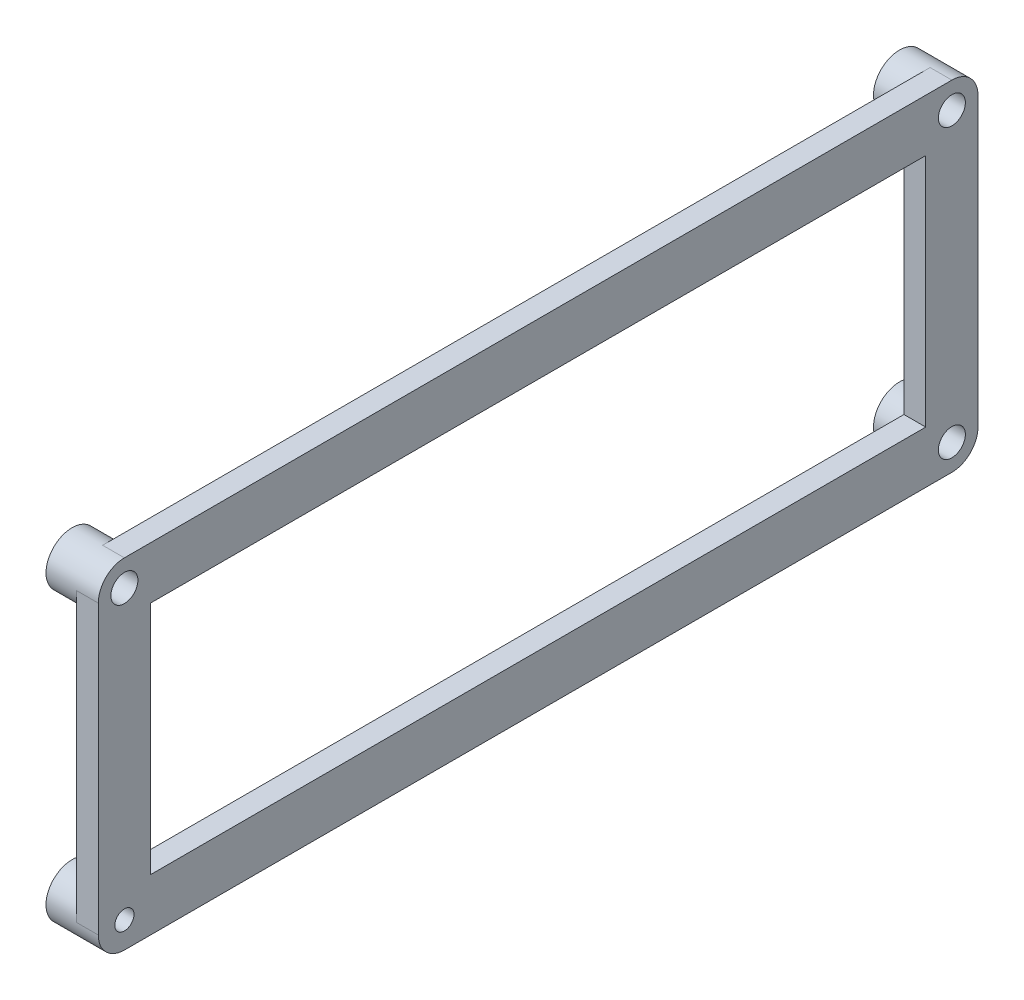
from build123d import *

# Parameters (mm, degrees)
SKETCH1_R             = 3
SKETCH1_R_2           = 1.55
BOSS_EXTRUDE1_DEPTH   = 3.5
BOSS_EXTRUDE1_2_DEPTH = 3.5
BOSS_EXTRUDE1_3_DEPTH = 3.5
BOSS_EXTRUDE1_4_DEPTH = 3.5
SKETCH2_R             = 3
SKETCH2_R_2           = 1.55
BOSS_EXTRUDE2_DEPTH   = 2.5
SKETCH3_W             = 6
SKETCH3_H             = 6
BOSS_EXTRUDE3_DEPTH   = 5
SKETCH4_W             = 6
SKETCH4_H             = 15
BOSS_EXTRUDE4_DEPTH   = 2.5
SKETCH5_W             = 4
SKETCH5_H             = 6
BOSS_EXTRUDE5_DEPTH   = 21.9
SKETCH6_W             = 6.7
SKETCH6_H             = 15
BOSS_EXTRUDE6_DEPTH   = 2.5
SKETCH7_R             = 1.55
SKETCH7_R_2           = 1.1
BOSS_EXTRUDE7_DEPTH   = 6


with BuildPart() as part:
    # Sketch1 → Boss-Extrude1 (new body)
    with BuildSketch(Plane(origin=(0, 0, 0), x_dir=(0, 0, -1), z_dir=(1, 0, 0))):
        with Locations((-47.5, 16.5)):
            Circle(SKETCH1_R)
        with Locations((-47.5, 16.5)):
            Circle(SKETCH1_R_2, mode=Mode.SUBTRACT)
    extrude(amount=BOSS_EXTRUDE1_DEPTH)



with BuildPart() as body_2:
    # Sketch1 → Boss-Extrude1 2 (new body)
    with BuildSketch(Plane(origin=(0, 0, 0), x_dir=(0, 0, -1), z_dir=(1, 0, 0))):
        with Locations((-47.5, -16.5)):
            Circle(SKETCH1_R)
        with Locations((-47.5, -16.5)):
            Circle(SKETCH1_R_2, mode=Mode.SUBTRACT)
    extrude(amount=BOSS_EXTRUDE1_2_DEPTH)


with BuildPart() as body_3:
    # Sketch1 → Boss-Extrude1 3 (new body)
    with BuildSketch(Plane(origin=(0, 0, 0), x_dir=(0, 0, -1), z_dir=(1, 0, 0))):
        with Locations((47.5, -16.5)):
            Circle(SKETCH1_R)
        with Locations((47.5, -16.5)):
            Circle(SKETCH1_R_2, mode=Mode.SUBTRACT)
    extrude(amount=BOSS_EXTRUDE1_3_DEPTH)


with BuildPart() as body_4:
    # Sketch1 → Boss-Extrude1 4 (new body)
    with BuildSketch(Plane(origin=(0, 0, 0), x_dir=(0, 0, -1), z_dir=(1, 0, 0))):
        with Locations((47.5, 16.5)):
            Circle(SKETCH1_R)
        with Locations((47.5, 16.5)):
            Circle(SKETCH1_R_2, mode=Mode.SUBTRACT)
    extrude(amount=BOSS_EXTRUDE1_4_DEPTH)


with BuildPart() as part_1:
    add(part.part)

    add(body_2.part)  # Boss-Extrude2 merges body 2

    add(body_3.part)  # Boss-Extrude2 merges body 3

    add(body_4.part)  # Boss-Extrude2 merges body 4
    # Sketch2 → Boss-Extrude2 (add)
    # profile 1 of 12: a face of its own
    with BuildSketch(Plane(origin=(3.5, 0, 0), x_dir=(0, 0, -1), z_dir=(1, 0, 0))):
        with BuildLine():
            Line((47.5, 19.5), (-47.5, 19.5))
            ThreePointArc((-47.5, 19.5), (-45.378679656, 18.621320344), (-44.5, 16.5))
            Line((-44.5, 16.5), (-44.5, 13.5))
            Line((-44.5, 13.5), (44.5, 13.5))
            Line((44.5, 13.5), (44.5, 16.5))
            ThreePointArc((44.5, 16.5), (45.378679656, 18.621320344), (47.5, 19.5))
        make_face()
    # profile 2 of 12: a face of its own
    with BuildSketch(Plane(origin=(3.5, 0, 0), x_dir=(0, 0, -1), z_dir=(1, 0, 0))):
        with Locations(Location((-47.5, 16.5, 0), (0, 0, 180))):
            Circle(SKETCH2_R)
        with Locations((-47.5, 16.5)):
            Circle(SKETCH2_R_2, mode=Mode.SUBTRACT)
    # profile 3 of 12: a face of its own
    with BuildSketch(Plane(origin=(3.5, 0, 0), x_dir=(0, 0, -1), z_dir=(1, 0, 0))):
        with BuildLine():
            Line((-44.5, 13.5), (-44.5, 16.5))
            ThreePointArc((-44.5, 16.5), (-45.378679656, 14.378679656), (-47.5, 13.5))
            Line((-47.5, 13.5), (-44.5, 13.5))
        make_face()
    # profile 4 of 12: a face of its own
    with BuildSketch(Plane(origin=(3.5, 0, 0), x_dir=(0, 0, -1), z_dir=(1, 0, 0))):
        with BuildLine():
            ThreePointArc((-47.5, 13.5), (-49.621320344, 14.378679656), (-50.5, 16.5))
            Line((-50.5, 16.5), (-50.5, -16.5))
            ThreePointArc((-50.5, -16.5), (-49.621320344, -14.378679656), (-47.5, -13.5))
            Line((-47.5, -13.5), (-44.5, -13.5))
            Line((-44.5, -13.5), (-44.5, 13.5))
            Line((-44.5, 13.5), (-47.5, 13.5))
        make_face()
    # profile 5 of 12: a face of its own
    with BuildSketch(Plane(origin=(3.5, 0, 0), x_dir=(0, 0, -1), z_dir=(1, 0, 0))):
        with BuildLine():
            Line((-44.5, -16.5), (-44.5, -13.5))
            Line((-44.5, -13.5), (-47.5, -13.5))
            ThreePointArc((-47.5, -13.5), (-45.378679656, -14.378679656), (-44.5, -16.5))
        make_face()
    # profile 6 of 12: a face of its own
    with BuildSketch(Plane(origin=(3.5, 0, 0), x_dir=(0, 0, -1), z_dir=(1, 0, 0))):
        with BuildLine():
            Line((44.5, -13.5), (-44.5, -13.5))
            Line((-44.5, -13.5), (-44.5, -16.5))
            ThreePointArc((-44.5, -16.5), (-45.378679656, -18.621320344), (-47.5, -19.5))
            Line((-47.5, -19.5), (47.5, -19.5))
            ThreePointArc((47.5, -19.5), (45.378679656, -18.621320344), (44.5, -16.5))
            Line((44.5, -16.5), (44.5, -13.5))
        make_face()
    # profile 7 of 12: a face of its own
    with BuildSketch(Plane(origin=(3.5, 0, 0), x_dir=(0, 0, -1), z_dir=(1, 0, 0))):
        with Locations(Location((-47.5, -16.5, 0), (0, 0, 180))):
            Circle(SKETCH2_R)
        with Locations((-47.5, -16.5)):
            Circle(SKETCH2_R_2, mode=Mode.SUBTRACT)
    # profile 8 of 12: a face of its own
    with BuildSketch(Plane(origin=(3.5, 0, 0), x_dir=(0, 0, -1), z_dir=(1, 0, 0))):
        with BuildLine():
            Line((50.5, -16.5), (50.5, 16.5))
            ThreePointArc((50.5, 16.5), (49.621320344, 14.378679656), (47.5, 13.5))
            Line((47.5, 13.5), (44.5, 13.5))
            Line((44.5, 13.5), (44.5, -13.5))
            Line((44.5, -13.5), (47.5, -13.5))
            ThreePointArc((47.5, -13.5), (49.621320344, -14.378679656), (50.5, -16.5))
        make_face()
    # profile 9 of 12: a face of its own
    with BuildSketch(Plane(origin=(3.5, 0, 0), x_dir=(0, 0, -1), z_dir=(1, 0, 0))):
        with BuildLine():
            ThreePointArc((44.5, -16.5), (45.378679656, -14.378679656), (47.5, -13.5))
            Line((47.5, -13.5), (44.5, -13.5))
            Line((44.5, -13.5), (44.5, -16.5))
        make_face()
    # profile 10 of 12: a face of its own
    with BuildSketch(Plane(origin=(3.5, 0, 0), x_dir=(0, 0, -1), z_dir=(1, 0, 0))):
        with Locations((47.5, -16.5)):
            Circle(SKETCH2_R)
        with Locations((47.5, -16.5)):
            Circle(SKETCH2_R_2, mode=Mode.SUBTRACT)
    # profile 11 of 12: a face of its own
    with BuildSketch(Plane(origin=(3.5, 0, 0), x_dir=(0, 0, -1), z_dir=(1, 0, 0))):
        with BuildLine():
            ThreePointArc((47.5, 13.5), (45.378679656, 14.378679656), (44.5, 16.5))
            Line((44.5, 16.5), (44.5, 13.5))
            Line((44.5, 13.5), (47.5, 13.5))
        make_face()
    # profile 12 of 12: a face of its own
    with BuildSketch(Plane(origin=(3.5, 0, 0), x_dir=(0, 0, -1), z_dir=(1, 0, 0))):
        with Locations((47.5, 16.5)):
            Circle(SKETCH2_R)
        with Locations((47.5, 16.5)):
            Circle(SKETCH2_R_2, mode=Mode.SUBTRACT)
    extrude(amount=BOSS_EXTRUDE2_DEPTH)

    # Sketch3 → Boss-Extrude3 (add)
    with BuildSketch(Plane(origin=(6, 0, 0), x_dir=(0, 0, -1), z_dir=(1, 0, 0))):
        with Locations((47.5, -10.5)):
            Rectangle(SKETCH3_W, SKETCH3_H)
        with Locations((-47.5, -10.5)):
            Rectangle(SKETCH3_W, SKETCH3_H)
    extrude(amount=BOSS_EXTRUDE3_DEPTH)

    # Sketch4 → Boss-Extrude4 (add)
    with BuildSketch(Plane(origin=(11, 0, 0), x_dir=(0, 0, -1), z_dir=(1, 0, 0))):
        with Locations((47.5, -15)):
            Rectangle(SKETCH4_W, SKETCH4_H)
    extrude(amount=BOSS_EXTRUDE4_DEPTH)

    # Sketch5 → Boss-Extrude5 (add)
    with BuildSketch(Plane.XY.offset(50.5)):
        with Locations((9, -10.5)):
            Rectangle(SKETCH5_W, SKETCH5_H)
    extrude(amount=BOSS_EXTRUDE5_DEPTH)

    # Sketch6 → Boss-Extrude6 (add)
    with BuildSketch(Plane(origin=(11, 0, 0), x_dir=(0, 0, -1), z_dir=(1, 0, 0))):
        with Locations((-69.05, -15)):
            Rectangle(SKETCH6_W, SKETCH6_H)
    extrude(amount=BOSS_EXTRUDE6_DEPTH)


with BuildPart() as body_2_2:
    # Split1: the piece on the far side of the plane
    add(part_1.part)
    split(bisect_by=Plane(origin=(6, 0, 0), x_dir=(0, 0, 1), z_dir=(1, 0, 0)), keep=Keep.BOTTOM)

    # Sketch7 → Boss-Extrude7 (add)
    with BuildSketch(Plane.ZY):
        with Locations((47.5, -16.5)):
            Circle(SKETCH7_R)
        with Locations((47.5, -16.5)):
            Circle(SKETCH7_R_2, mode=Mode.SUBTRACT)
    extrude(amount=-BOSS_EXTRUDE7_DEPTH)


with BuildPart() as part_2:
    add(part_1.part)

    # Split1
    split(bisect_by=Plane(origin=(6, 0, 0), x_dir=(0, 0, 1), z_dir=(1, 0, 0)), keep=Keep.TOP)


solid = body_2_2.part
